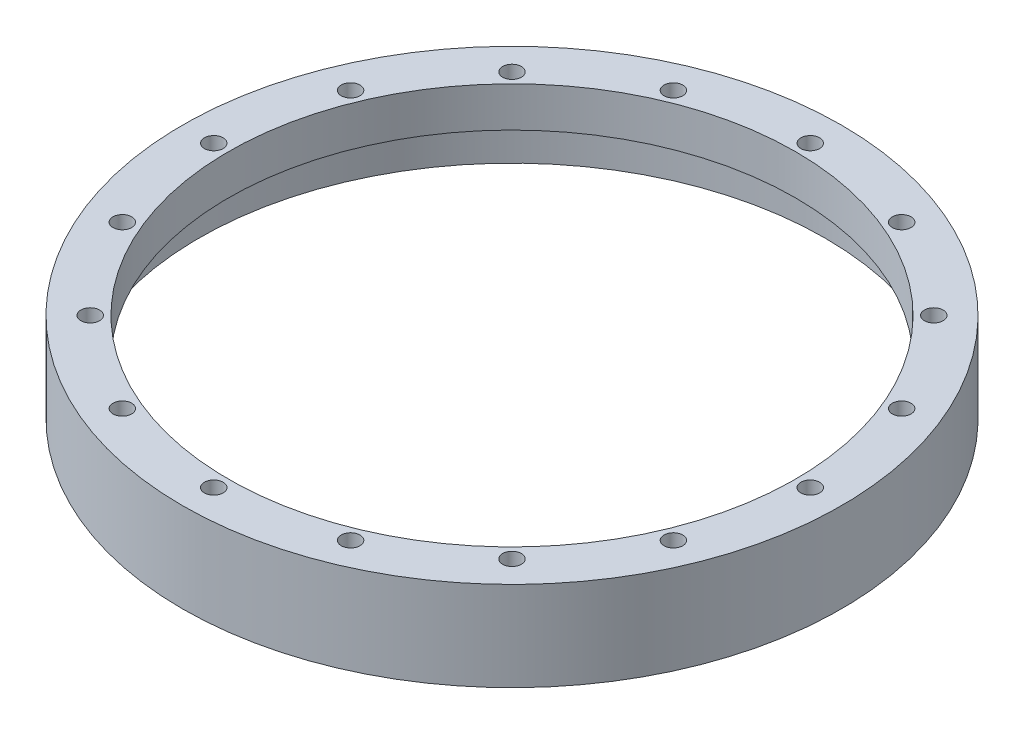
from build123d import *

# Parameters (mm, degrees)
CIRPATTERN1_COUNT = 16


with BuildPart() as part:
    # Sketch1 → Revolve1 (revolve)
    with BuildSketch(Plane.XY, mode=Mode.PRIVATE) as revolve1_sk:
        Polygon((-49.4665, 0), (-57.4802, 0), (-57.4802, -15.5956), (-54.5719, -15.5956), (-54.5719, -6.985), (-49.4665, -6.985), align=None)
    revolve(revolve1_sk.sketch.rotate(Axis((0, 0, 0), (0, 1, 0)), 270), axis=Axis((0, 0, 0), (0, 1, 0)))

    # Sketch3 → #4 Clearance Hole1 (revolve, cut)
    with BuildSketch(Plane(origin=(0, 0, -52.0192), x_dir=(0, 0, 1), z_dir=(1, 0, 0))):
        Polygon((0, 0), (0, 11.140574487), (1.63195, 10.16), (1.63195, 0), align=None)
    f_4_clearance_hole1 = revolve(axis=Axis((0, 6.35, -52.0192), (0, -1, 0)), mode=Mode.SUBTRACT)

    # CirPattern1: #4 Clearance Hole1 ×16 about axis
    cirpattern1_axis = Axis((0, 0, 0), (0, 1, 0))
    for i in range(1, CIRPATTERN1_COUNT):
        add(f_4_clearance_hole1.rotate(cirpattern1_axis, i * 360 / CIRPATTERN1_COUNT), mode=Mode.SUBTRACT)


solid = part.part
